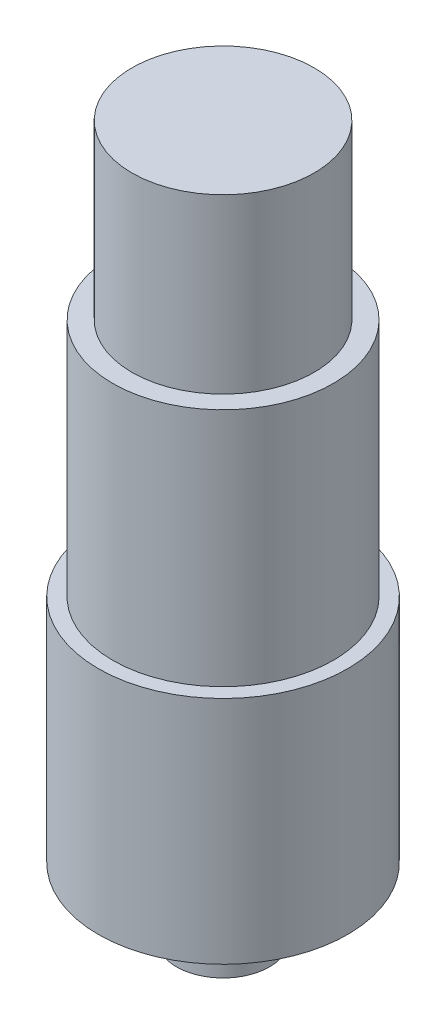
from build123d import *

# Parameters (mm, degrees)
SKETCH_1_W   = 9.5
SKETCH_1_H   = 6
SKETCH_1_W_2 = 4.85
SKETCH_1_H_2 = 7


with BuildPart() as part:
    # Эскиз1 → Повернуть1 (revolve)
    with BuildSketch(Plane.XY, mode=Mode.PRIVATE) as revolve_1_sk:
        with Locations((4.75, 64)):
            Rectangle(SKETCH_1_W, SKETCH_1_H)
        Polygon((9.5, 61), (0, 61), (0, 0), (4.85, 0), (13, 0), (13, 24), (11.5, 24), (11.5, 49), (9.5, 49), align=None)
        with Locations((2.425, -3.5)):
            Rectangle(SKETCH_1_W_2, SKETCH_1_H_2)
    revolve(revolve_1_sk.sketch.rotate(Axis((0, 73.447142448, 0), (0, -1, 0)), 90), axis=Axis((0, 73.447142448, 0), (0, -1, 0)))


solid = part.part
